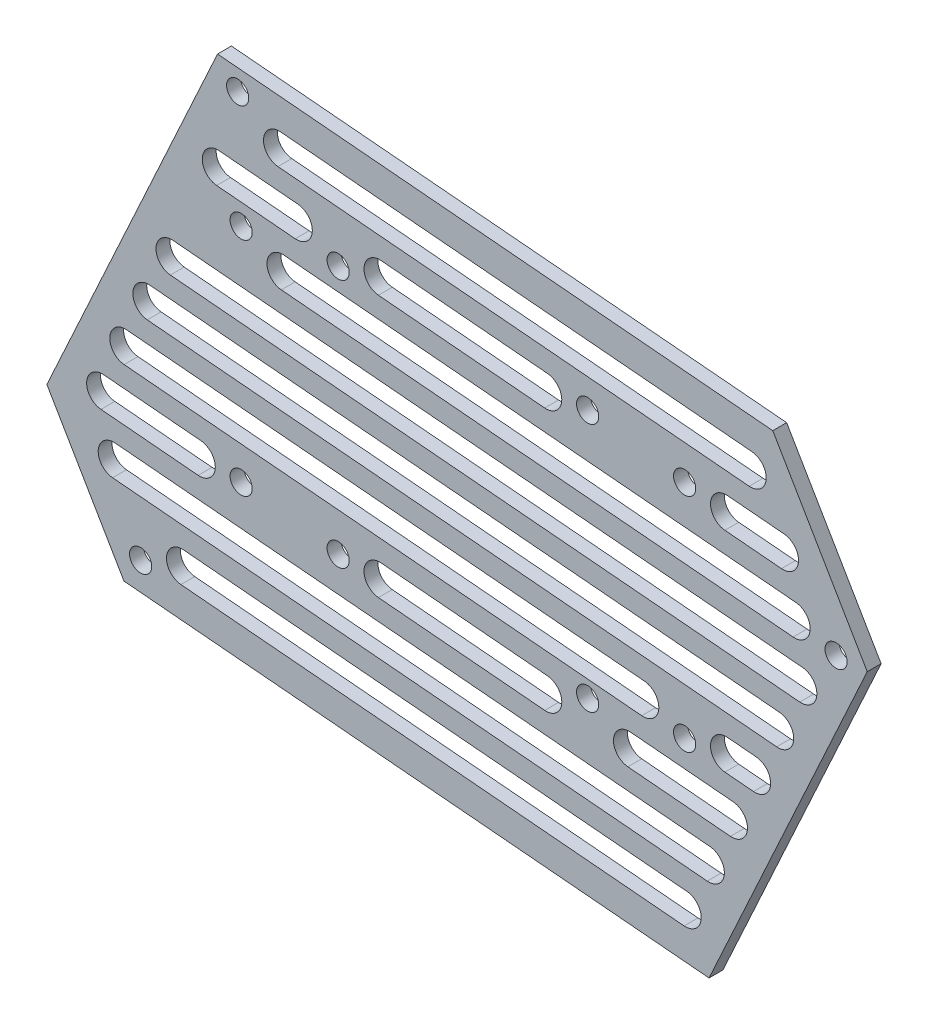
from build123d import *

# Parameters (mm, degrees)
SKETCH2_R           = 1.6
BOSS_EXTRUDE1_DEPTH = 2
SKETCH3_R           = 1.6
CUT_EXTRUDE1_DEPTH  = 10
SKETCH4_R           = 1.6
CUT_EXTRUDE2_DEPTH  = 10
CUT_EXTRUDE3_DEPTH  = 10


with BuildPart() as part:
    # Sketch2 → Boss-Extrude1 (new body)
    with BuildSketch(Plane.XY.offset(20)):
        Polygon((252.288649586, 43.377799412), (275.117398408, 93.06941092), (261.484759484, 116.375014451), (181.365813862, 123.384513926), (156.737856831, 69.776544321), (167.859011127, 50.764435642), align=None)
        with Locations((184.267611591, 120.119180009)):
            Circle(SKETCH2_R, mode=Mode.SUBTRACT)
        with Locations((270.61335305, 92.847113196)):
            Circle(SKETCH2_R, mode=Mode.SUBTRACT)
        with Locations((170.267611591, 54.568989757)):
            Circle(SKETCH2_R, mode=Mode.SUBTRACT)
    extrude(amount=BOSS_EXTRUDE1_DEPTH)

    # Sketch3 → Cut-Extrude1 (cut)
    with BuildSketch(Plane.XY.offset(22)):
        with Locations((184.767611591, 103.568989757)):
            Circle(SKETCH3_R)
        with Locations((248.767611591, 103.568989757)):
            Circle(SKETCH3_R)
        with Locations((184.767611591, 71.568989757)):
            Circle(SKETCH3_R)
        with Locations((248.767611591, 71.568989757)):
            Circle(SKETCH3_R)
    extrude(amount=-CUT_EXTRUDE1_DEPTH, mode=Mode.SUBTRACT)

    # Sketch4 → Cut-Extrude2 (cut)
    with BuildSketch(Plane.XY.offset(22)):
        with Locations((198.767683591, 105.568953757)):
            Circle(SKETCH4_R)
        with Locations((234.767611591, 105.568953757)):
            Circle(SKETCH4_R)
        with Locations((198.767683591, 69.569025757)):
            Circle(SKETCH4_R)
        with Locations((234.767611591, 69.568989757)):
            Circle(SKETCH4_R)
    extrude(amount=-CUT_EXTRUDE2_DEPTH, mode=Mode.SUBTRACT)

    # Sketch5 → Cut-Extrude3 (cut)
    with BuildSketch(Plane.XY.offset(22)):
        with BuildLine():
            Line((190.465455127, 118.196686684), (258.46886477, 112.247159259))
            ThreePointArc((258.46886477, 112.247159259), (260.532383199, 109.787953759), (258.073177698, 107.72443533))
            Line((258.073177698, 107.72443533), (190.069768055, 113.673962755))
            ThreePointArc((190.069768055, 113.673962755), (188.006249627, 116.133168256), (190.465455127, 118.196686684))
        make_face()
        with BuildLine():
            Line((181.627000542, 111.411187887), (192.965527127, 110.41919535))
            ThreePointArc((192.965527127, 110.41919535), (195.029045556, 107.959989849), (192.569840055, 105.89647142))
            Line((192.569840055, 105.89647142), (181.23131347, 106.888463958))
            ThreePointArc((181.23131347, 106.888463958), (179.167795041, 109.347669458), (181.627000542, 111.411187887))
        make_face()
        with BuildLine():
            Line((204.965527127, 109.369331387), (228.965455127, 107.269609762))
            ThreePointArc((228.965455127, 107.269609762), (231.028973556, 104.810404261), (228.569768055, 102.746885833))
            Line((228.569768055, 102.746885833), (204.569840055, 104.846607458))
            ThreePointArc((204.569840055, 104.846607458), (202.506321627, 107.305812959), (204.965527127, 109.369331387))
        make_face()
        with BuildLine():
            Line((254.965455127, 104.99490451), (263.128854265, 104.28069963))
            ThreePointArc((263.128854265, 104.28069963), (265.192372694, 101.821494129), (262.733167193, 99.7579757))
            Line((262.733167193, 99.7579757), (254.569768055, 100.472180581))
            ThreePointArc((254.569768055, 100.472180581), (252.506249627, 102.931386082), (254.965455127, 104.99490451))
        make_face()
        with BuildLine():
            Line((190.965455127, 103.035415599), (264.811196586, 96.574750372))
            ThreePointArc((264.811196586, 96.574750372), (266.874715015, 94.115544871), (264.415509514, 92.052026442))
            Line((264.415509514, 92.052026442), (190.569768055, 98.51269167))
            ThreePointArc((190.569768055, 98.51269167), (188.506249627, 100.971897171), (190.965455127, 103.035415599))
        make_face()
        with BuildLine():
            Line((174.950239512, 96.877802033), (265.772651965, 88.931870549))
            ThreePointArc((265.772651965, 88.931870549), (267.836170393, 86.472665048), (265.376964893, 84.40914662))
            Line((265.376964893, 84.40914662), (174.55455244, 92.355078103))
            ThreePointArc((174.55455244, 92.355078103), (172.491034011, 94.814283604), (174.950239512, 96.877802033))
        make_face()
        with BuildLine():
            Line((171.611858997, 89.611109106), (262.43427145, 81.665177622))
            ThreePointArc((262.43427145, 81.665177622), (264.497789879, 79.205972121), (262.038584378, 77.142453693))
            Line((262.038584378, 77.142453693), (171.216171925, 85.088385176))
            ThreePointArc((171.216171925, 85.088385176), (169.152653497, 87.547590677), (171.611858997, 89.611109106))
        make_face()
        with BuildLine():
            Line((168.277911923, 82.354066501), (242.965455127, 75.819753164))
            ThreePointArc((242.965455127, 75.819753164), (245.028973556, 73.360547663), (242.569768055, 71.297029235))
            Line((242.569768055, 71.297029235), (167.882224851, 77.831342572))
            ThreePointArc((167.882224851, 77.831342572), (165.818706422, 80.290548072), (168.277911923, 82.354066501))
        make_face()
        with BuildLine():
            Line((254.965455127, 74.769889202), (259.100324376, 74.408135017))
            ThreePointArc((259.100324376, 74.408135017), (261.163842804, 71.948929517), (258.704637304, 69.885411088))
            Line((258.704637304, 69.885411088), (254.569768055, 70.247165272))
            ThreePointArc((254.569768055, 70.247165272), (252.506249627, 72.706370773), (254.965455127, 74.769889202))
        make_face()
        with BuildLine():
            Line((164.939531408, 75.087373574), (178.965529659, 73.860257732))
            ThreePointArc((178.965529659, 73.860257732), (181.029048087, 71.401052232), (178.569842586, 69.337533803))
            Line((178.569842586, 69.337533803), (164.543844336, 70.564649645))
            ThreePointArc((164.543844336, 70.564649645), (162.480325907, 73.023855145), (164.939531408, 75.087373574))
        make_face()
        with BuildLine():
            Line((204.965527127, 71.585552702), (228.965455127, 69.485831077))
            ThreePointArc((228.965455127, 69.485831077), (231.028973556, 67.026625576), (228.569768055, 64.963107147))
            Line((228.569768055, 64.963107147), (204.569840055, 67.062828773))
            ThreePointArc((204.569840055, 67.062828773), (202.506321627, 69.522034274), (204.965527127, 71.585552702))
        make_face()
        with BuildLine():
            Line((240.965455127, 68.435967114), (255.761943861, 67.14144209))
            ThreePointArc((255.761943861, 67.14144209), (257.82546229, 64.68223659), (255.366256789, 62.618718161))
            Line((255.366256789, 62.618718161), (240.569768055, 63.913243185))
            ThreePointArc((240.569768055, 63.913243185), (238.506249627, 66.372448686), (240.965455127, 68.435967114))
        make_face()
        with BuildLine():
            Line((166.610026404, 67.382460823), (252.423563346, 59.874749163))
            ThreePointArc((252.423563346, 59.874749163), (254.487081775, 57.415543662), (252.027876274, 55.352025234))
            Line((252.027876274, 55.352025234), (166.214339332, 62.859736893))
            ThreePointArc((166.214339332, 62.859736893), (164.150820903, 65.318942394), (166.610026404, 67.382460823))
        make_face()
        with BuildLine():
            Line((176.465455127, 58.961459158), (249.085182831, 52.608056236))
            ThreePointArc((249.085182831, 52.608056236), (251.14870126, 50.148850735), (248.689495759, 48.085332307))
            Line((248.689495759, 48.085332307), (176.069768055, 54.438735229))
            ThreePointArc((176.069768055, 54.438735229), (174.006249627, 56.89794073), (176.465455127, 58.961459158))
        make_face()
    extrude(amount=-CUT_EXTRUDE3_DEPTH, mode=Mode.SUBTRACT)


solid = part.part
